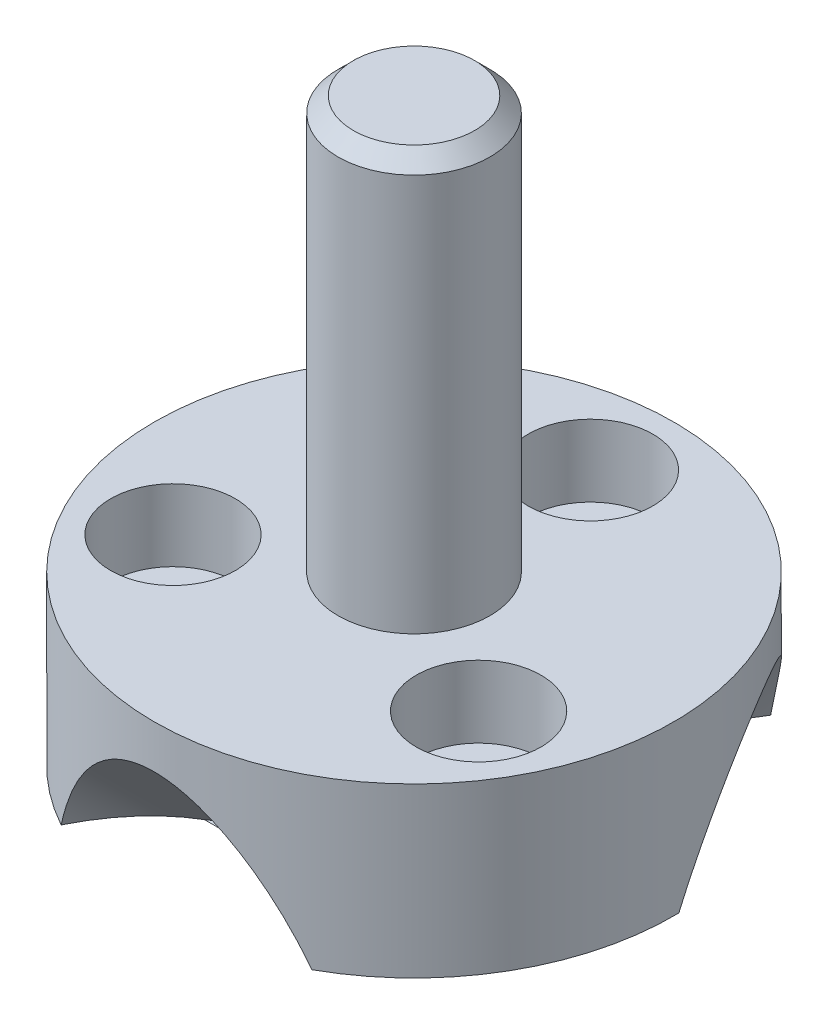
from build123d import *

# Parameters (mm, degrees)
SKETCH1_R           = 8.5
BOSS_EXTRUDE1_DEPTH = 5.5
SKETCH2_R           = 2.485
BOSS_EXTRUDE2_DEPTH = 13.5
CHAMFER1_SIZE       = 0.5
SKETCH5_R           = 4.5
CUT_EXTRUDE3_DEPTH  = 2.54
SKETCH3_R           = 2.04
CUT_EXTRUDE1_DEPTH  = 2.35
SKETCH4_R           = 1.065
CUT_EXTRUDE2_DEPTH  = 22.35
SKETCH7_R           = 5
CUT_EXTRUDE5_DEPTH  = 11.54
CIRPATTERN1_COUNT   = 3


with BuildPart() as part:
    # Sketch1 → Boss-Extrude1 (new body)
    with BuildSketch(Plane(origin=(0, 0, 0), x_dir=(1, 0, 0), z_dir=(0, 1, 0))):
        with Locations(Location((0, 0, 0), (0, 0, 270))):
            Circle(SKETCH1_R)
    extrude(amount=BOSS_EXTRUDE1_DEPTH)

    # Sketch2 → Boss-Extrude2 (add)
    with BuildSketch(Plane(origin=(0, 5.5, 0), x_dir=(1, 0, 0), z_dir=(0, 1, 0))):
        with Locations(Location((0, 0, 0), (0, 0, 270))):
            Circle(SKETCH2_R)
    extrude(amount=BOSS_EXTRUDE2_DEPTH)

    # Chamfer1
    chamfer1_edges = [part.edges().sort_by_distance(p)[0] for p in [
        (0, 19, -2.485),
    ]]
    chamfer(chamfer1_edges, length=CHAMFER1_SIZE)

    # Sketch5 → Cut-Extrude3 (cut)
    with BuildSketch(Plane.XZ):
        with Locations(Location((0, 0, 0), (0, 0, 270))):
            Circle(SKETCH5_R)
    extrude(amount=-CUT_EXTRUDE3_DEPTH, mode=Mode.SUBTRACT)

    # Sketch3 → Cut-Extrude1 (cut)
    with BuildSketch(Plane(origin=(0, 5.5, 0), x_dir=(1, 0, 0), z_dir=(0, 1, 0))):
        with Locations(Location((0, 5.773502692, 0), (0, 0, 270))):
            Circle(SKETCH3_R)
        with Locations(Location((5, -2.886751346, 0), (0, 0, 270))):
            Circle(SKETCH3_R)
        with Locations(Location((-5, -2.886751346, 0), (0, 0, 270))):
            Circle(SKETCH3_R)
    extrude(amount=-CUT_EXTRUDE1_DEPTH, mode=Mode.SUBTRACT)

    # Sketch4 → Cut-Extrude2 (cut)
    with BuildSketch(Plane(origin=(0, 3.15, 0), x_dir=(1, 0, 0), z_dir=(0, 1, 0))):
        with Locations(Location((0, 5.773502692, 0), (0, 0, 270))):
            Circle(SKETCH4_R)
        with Locations(Location((5, -2.886751346, 0), (0, 0, 270))):
            Circle(SKETCH4_R)
        with Locations(Location((-5, -2.886751346, 0), (0, 0, 270))):
            Circle(SKETCH4_R)
    extrude(amount=-CUT_EXTRUDE2_DEPTH, mode=Mode.SUBTRACT)

    # Sketch7 → Cut-Extrude5 (cut)
    with BuildSketch(Plane(origin=(0, 2.474873734, 2.474873734), x_dir=(1, 0, 0), z_dir=(0, 0.7071067811865476, 0.7071067811865476))):
        with Locations((0, -8.121320344)):
            Circle(SKETCH7_R)
    cut_extrude5 = extrude(amount=CUT_EXTRUDE5_DEPTH, mode=Mode.SUBTRACT)

    # CirPattern1: Cut-Extrude5 ×3 about axis
    cirpattern1_axis = Axis((0, 0, 0), (0, 1, 0))
    for i in range(1, CIRPATTERN1_COUNT):
        add(cut_extrude5.rotate(cirpattern1_axis, i * 360 / CIRPATTERN1_COUNT), mode=Mode.SUBTRACT)


solid = part.part
